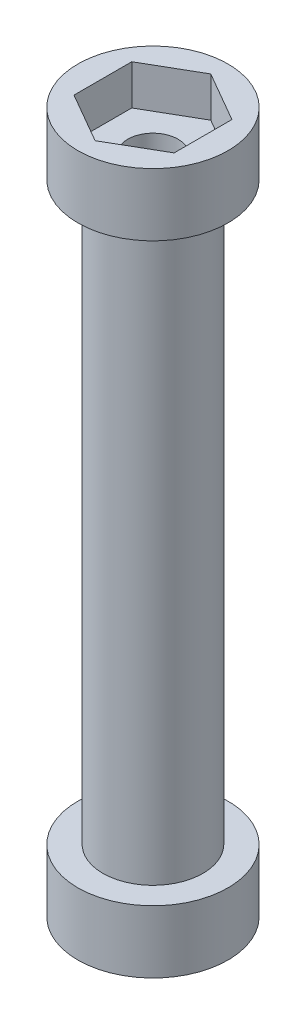
from build123d import *

# Parameters (mm, degrees)
SKETCH_1_R          = 2
SKETCH_1_R_2        = 1
EXTRUDE_1_DEPTH     = 28
SKETCH_2_R          = 3
SKETCH_2_R_2        = 2
EXTRUDE_2_DEPTH     = 2.5
EXTRUDE_START       = 25.5
SKETCH_3_R          = 3
SKETCH_3_R_2        = 2
EXTRUDE_3_DEPTH     = 2.5
SKETCH_4_R          = 1.6
CUT_EXTRUDE_1_DEPTH = 1.5
CUT_EXTRUDE_START   = 28
CUT_EXTRUDE_2_DEPTH = 1.6


with BuildPart() as part:
    # 草图1 → 凸台-拉伸1 (new body)
    with BuildSketch(Plane(origin=(0, 0, 0), x_dir=(1, 0, 0), z_dir=(0, 1, 0))):
        with Locations(Location((0, 0, 0), (0, 0, 270))):
            Circle(SKETCH_1_R)
        with Locations(Location((0, 0, 0), (0, 0, 270))):
            Circle(SKETCH_1_R_2, mode=Mode.SUBTRACT)
    extrude(amount=EXTRUDE_1_DEPTH)

    # 草图2 → 凸台-拉伸2 (add)
    with BuildSketch(Plane(origin=(0, 0, 0), x_dir=(1, 0, 0), z_dir=(0, 1, 0))):
        with Locations(Location((0, 0, 0), (0, 0, 270))):
            Circle(SKETCH_2_R)
        with Locations(Location((0, 0, 0), (0, 0, 270))):
            Circle(SKETCH_2_R_2, mode=Mode.SUBTRACT)
    extrude(amount=EXTRUDE_2_DEPTH)

    # 草图3 → 凸台-拉伸3 (add)
    with BuildSketch(Plane(origin=(0, 0, 0), x_dir=(1, 0, 0), z_dir=(0, 1, 0)).offset(EXTRUDE_START)):
        with Locations(Location((0, 0, 0), (0, 0, 270))):
            Circle(SKETCH_3_R)
        with Locations(Location((0, 0, 0), (0, 0, 270))):
            Circle(SKETCH_3_R_2, mode=Mode.SUBTRACT)
    extrude(amount=EXTRUDE_3_DEPTH)

    # 草图4 → 切除-拉伸1 (cut)
    with BuildSketch(Plane(origin=(0, 0, 0), x_dir=(1, 0, 0), z_dir=(0, 1, 0))):
        with Locations(Location((0, 0, 0), (0, 0, 270))):
            Circle(SKETCH_4_R)
    extrude(amount=CUT_EXTRUDE_1_DEPTH, mode=Mode.SUBTRACT)

    # 草图5 → 切除-拉伸2 (cut)
    with BuildSketch(Plane(origin=(0, 0, 0), x_dir=(1, 0, 0), z_dir=(0, 1, 0)).offset(CUT_EXTRUDE_START)):
        Polygon((0, -2.309401077), (2, -1.154700538), (2, 1.154700538), (0, 2.309401077), (-2, 1.154700538), (-2, -1.154700538), align=None)
    extrude(amount=-CUT_EXTRUDE_2_DEPTH, mode=Mode.SUBTRACT)


solid = part.part
